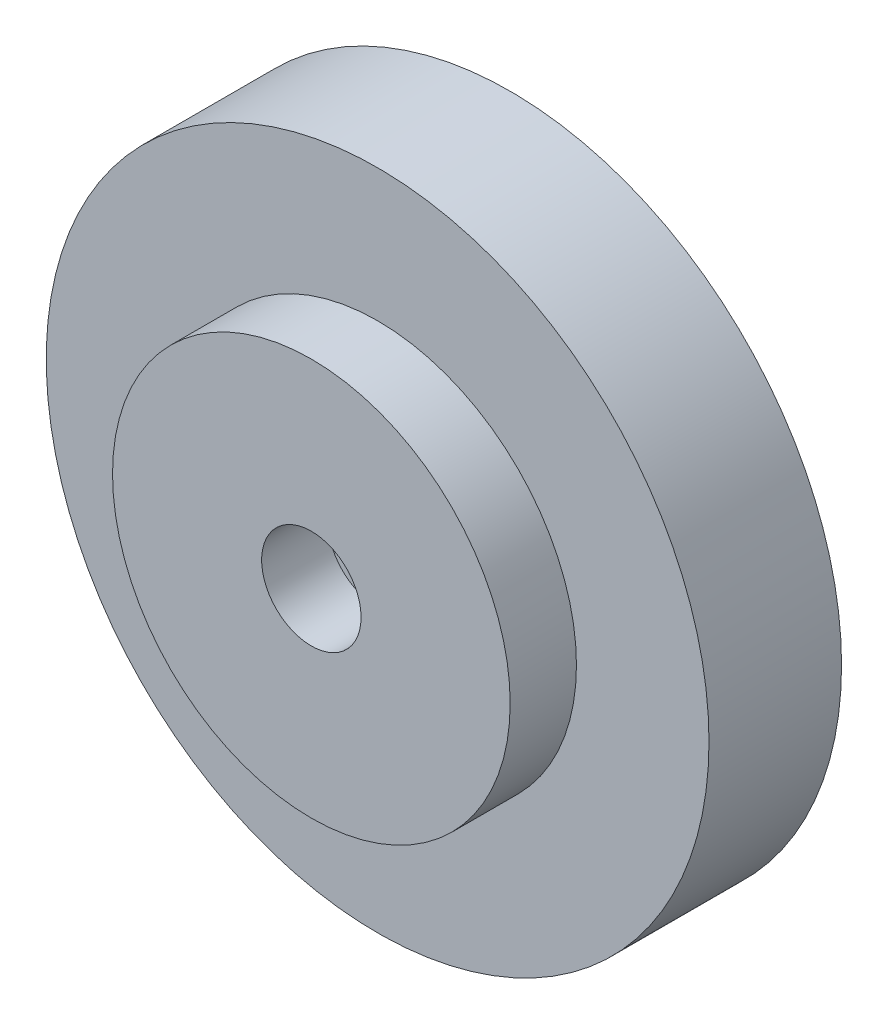
from build123d import *

# Parameters (mm, degrees)
SKETCH1_R           = 50
BOSS_EXTRUDE1_DEPTH = 20
SKETCH2_R           = 30
BOSS_EXTRUDE2_DEPTH = 10
SKETCH3_R           = 7.5
CUT_EXTRUDE1_DEPTH  = 10


with BuildPart() as part:
    # Sketch1 → Boss-Extrude1 (new body)
    with BuildSketch(Plane.XY):
        Circle(SKETCH1_R)
    extrude(amount=BOSS_EXTRUDE1_DEPTH)

    # Sketch2 → Boss-Extrude2 (add)
    with BuildSketch(Plane.XY.offset(20)):
        Circle(SKETCH2_R)
    extrude(amount=BOSS_EXTRUDE2_DEPTH)

    # Sketch3 → Cut-Extrude1 (cut)
    with BuildSketch(Plane.XY.offset(30)):
        Circle(SKETCH3_R)
    extrude(amount=-CUT_EXTRUDE1_DEPTH, mode=Mode.SUBTRACT)


solid = part.part
